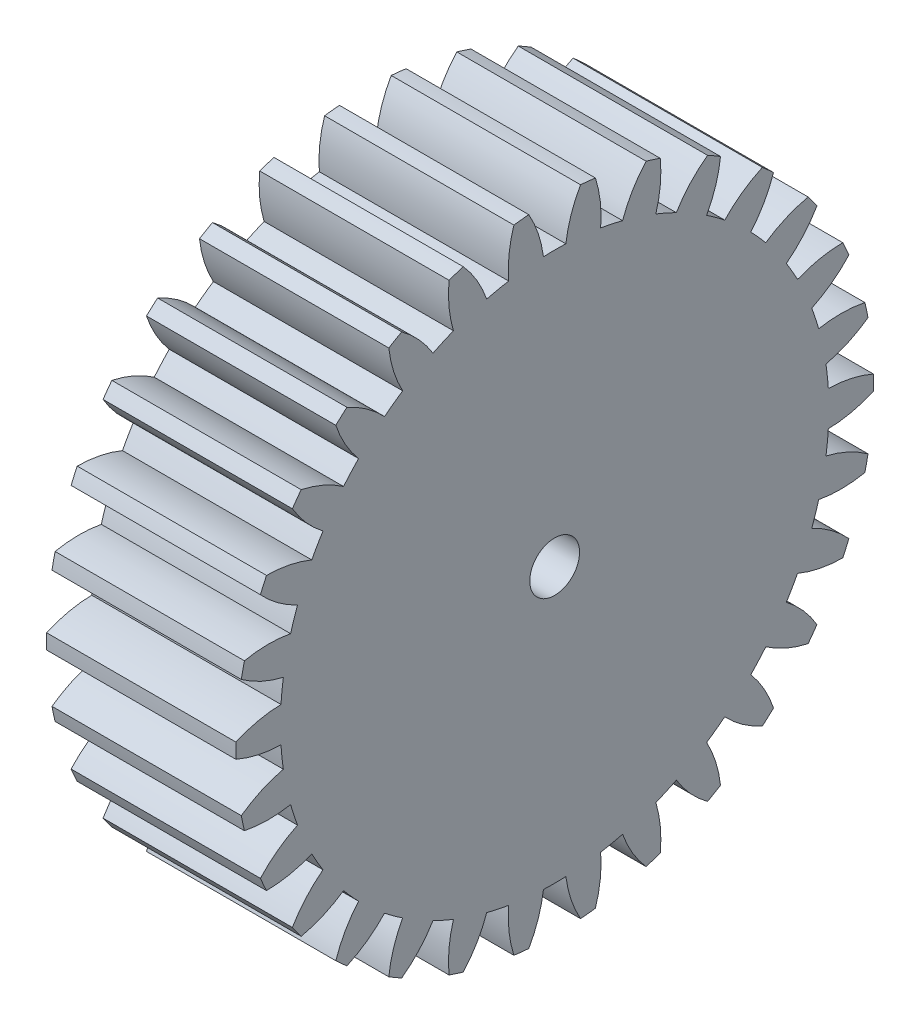
from build123d import *

# Parameters (mm, degrees)
BASPROSKE_W     = 12.065
BASPROSKE_H     = 20.32
TOOTHCUT_DEPTH  = 32.166793627
TEETHCUTS_COUNT = 30
TEETHCUTS_ANGLE = 348
BORSKE_R        = 1.5875
BORE_DEPTH      = 50.8000508


with BuildPart() as part:
    # BasProSke → Base-Revolve (revolve)
    with BuildSketch(Plane(origin=(0, 0, 0), x_dir=(1, 0, 0), z_dir=(0, 1, 0)), mode=Mode.PRIVATE) as base_revolve_sk:
        with Locations((6.0325, 10.16)):
            Rectangle(BASPROSKE_W, BASPROSKE_H)
    revolve(base_revolve_sk.sketch.rotate(Axis((-10, 0, 0), (1, 0, 0)), 180), axis=Axis((-10, 0, 0), (1, 0, 0)))

    # TooCutSke → ToothCut (cut, through all)
    with BuildSketch(Plane(origin=(0, 0, 0), x_dir=(0, 0, -1), z_dir=(1, 0, 0))):
        with BuildLine():
            ThreePointArc((0.714715216, 17.460578375), (0, 17.4752), (-0.714715216, 17.460578375))
            ThreePointArc((-0.714715216, 17.460578375), (-1.050238138, 18.915631959), (-1.663083224, 20.27731381))
            ThreePointArc((-1.663083224, 20.27731381), (0, 20.3454), (1.663083224, 20.27731381))
            ThreePointArc((1.663083224, 20.27731381), (1.050238138, 18.915631959), (0.714715216, 17.460578375))
        make_face()
    toothcut = extrude(amount=TOOTHCUT_DEPTH, mode=Mode.SUBTRACT)

    # TeethCuts: ToothCut ×30 about axis
    teethcuts_axis = Axis((-10, 0, 0), (1, 0, 0))
    for i in range(1, TEETHCUTS_COUNT):
        add(toothcut.rotate(teethcuts_axis, i * TEETHCUTS_ANGLE / (TEETHCUTS_COUNT - 1)), mode=Mode.SUBTRACT)

    # BorSke → Bore (cut, symmetric)
    with BuildSketch(Plane(origin=(0, 0, 0), x_dir=(0, 0, -1), z_dir=(1, 0, 0))):
        with Locations(Location((0, 0, 0), (0, 0, 180))):
            Circle(BORSKE_R)
    extrude(amount=BORE_DEPTH, both=True, mode=Mode.SUBTRACT)


solid = part.part
